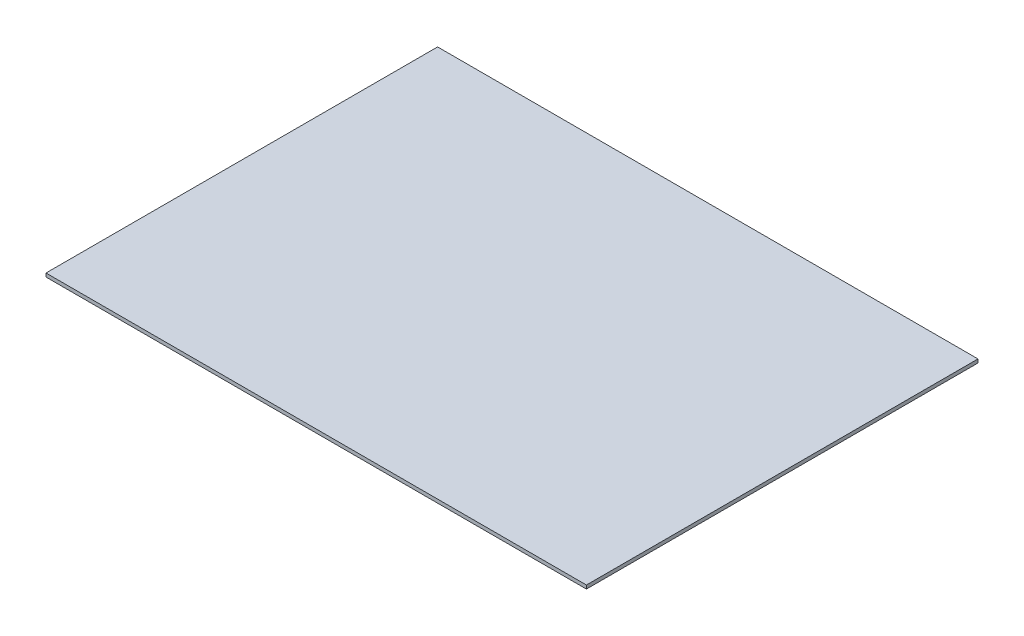
from build123d import *

# Parameters (mm, degrees)
SKETCH1_W           = 1525
SKETCH1_H           = 1105
BOSS_EXTRUDE1_DEPTH = 10


with BuildPart() as part:
    # Sketch1 → Boss-Extrude1 (new body)
    with BuildSketch(Plane(origin=(0, 0, 0), x_dir=(1, 0, 0), z_dir=(0, 1, 0))):
        Rectangle(SKETCH1_W, SKETCH1_H)
    extrude(amount=-BOSS_EXTRUDE1_DEPTH)


solid = part.part
